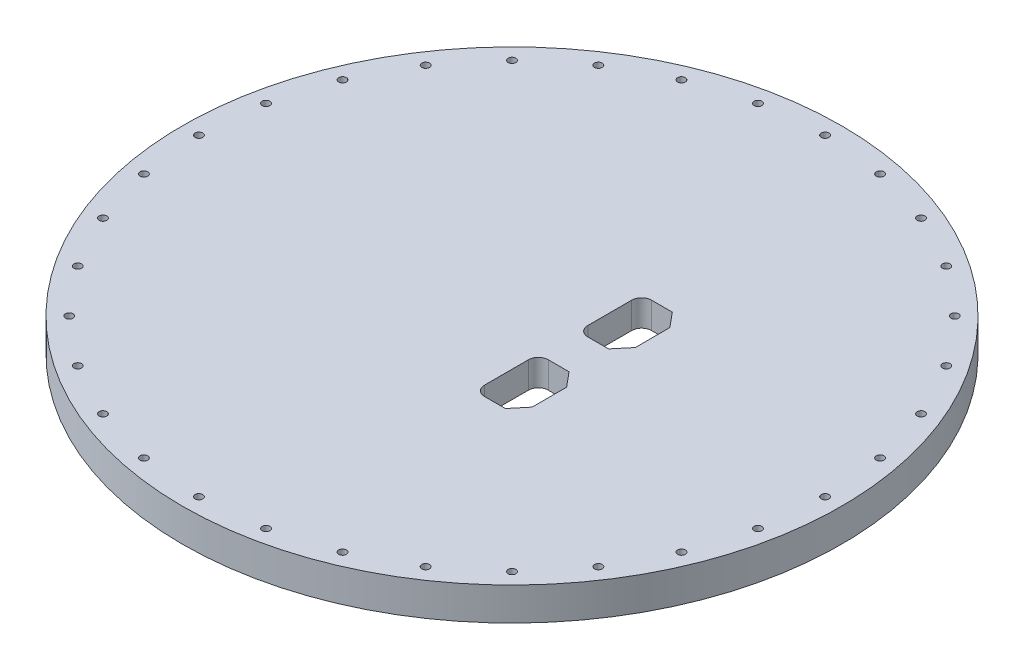
from build123d import *

# Parameters (mm, degrees)
CUT_EXTRUDE2_DEPTH = 1.2
SKETCH4_R          = 0.175
CUT_EXTRUDE3_DEPTH = 1.5
CIRPATTERN1_COUNT  = 32
SCALE1_SCALE       = 5


with BuildPart() as part:
    # Sketch2 → Revolve1 (revolve)
    with BuildSketch(Plane.XY, mode=Mode.PRIVATE) as revolve1_sk:
        Polygon((13.5, 0), (13.5, 0.3), (0, 0.3), (0, 1.5), (15, 1.5), (15, 0), align=None)
    revolve(revolve1_sk.sketch.rotate(Axis((0, 0, 0), (0, 1, 0)), 90), axis=Axis((0, 0, 0), (0, 1, 0)))

    # Sketch3 → Cut-Extrude2 (cut)
    with BuildSketch(Plane(origin=(0, 1.5, 0), x_dir=(1, 0, 0), z_dir=(0, 1, 0))):
        with BuildLine():
            Line((2.1, -3.35), (2.1, -1.35))
            ThreePointArc((2.1, -1.35), (2.231801948, -1.031801948), (2.55, -0.9))
            Line((2.55, -0.9), (3.496837495, -0.9))
            Line((3.496837495, -0.9), (4.05, -1.563795006))
            Line((4.05, -1.563795006), (4.05, -3.136204994))
            Line((4.05, -3.136204994), (3.496837495, -3.8))
            Line((3.496837495, -3.8), (2.55, -3.8))
            ThreePointArc((2.55, -3.8), (2.231801948, -3.668198052), (2.1, -3.35))
        make_face()
        with BuildLine():
            Line((3.496837495, 3.8), (2.55, 3.8))
            ThreePointArc((2.55, 3.8), (2.231801948, 3.668198052), (2.1, 3.35))
            Line((2.1, 3.35), (2.1, 1.35))
            ThreePointArc((2.1, 1.35), (2.231801948, 1.031801948), (2.55, 0.9))
            Line((2.55, 0.9), (3.496837495, 0.9))
            Line((3.496837495, 0.9), (4.05, 1.563795006))
            Line((4.05, 1.563795006), (4.05, 3.136204994))
            Line((4.05, 3.136204994), (3.496837495, 3.8))
        make_face()
    extrude(amount=-CUT_EXTRUDE2_DEPTH, mode=Mode.SUBTRACT)

    # Sketch4 → Cut-Extrude3 (cut)
    with BuildSketch(Plane(origin=(0, 1.5, 0), x_dir=(1, 0, 0), z_dir=(0, 1, 0))):
        with Locations(Location((14.25, 0, 0), (0, 0, 270))):
            Circle(SKETCH4_R)
    cut_extrude3 = extrude(amount=-CUT_EXTRUDE3_DEPTH, mode=Mode.SUBTRACT)

    # CirPattern1: Cut-Extrude3 ×32 about axis
    cirpattern1_axis = Axis((0, 0, 0), (0, 1, 0))
    for i in range(1, CIRPATTERN1_COUNT):
        add(cut_extrude3.rotate(cirpattern1_axis, i * 360 / CIRPATTERN1_COUNT), mode=Mode.SUBTRACT)


with BuildPart() as part_1:
    # Scale1: scaled about (-0.043455852, 0.866118001, 0)
    add(part.part.scale(SCALE1_SCALE).moved(Location((0.173823408, -3.464472004, 0))))


solid = part_1.part
